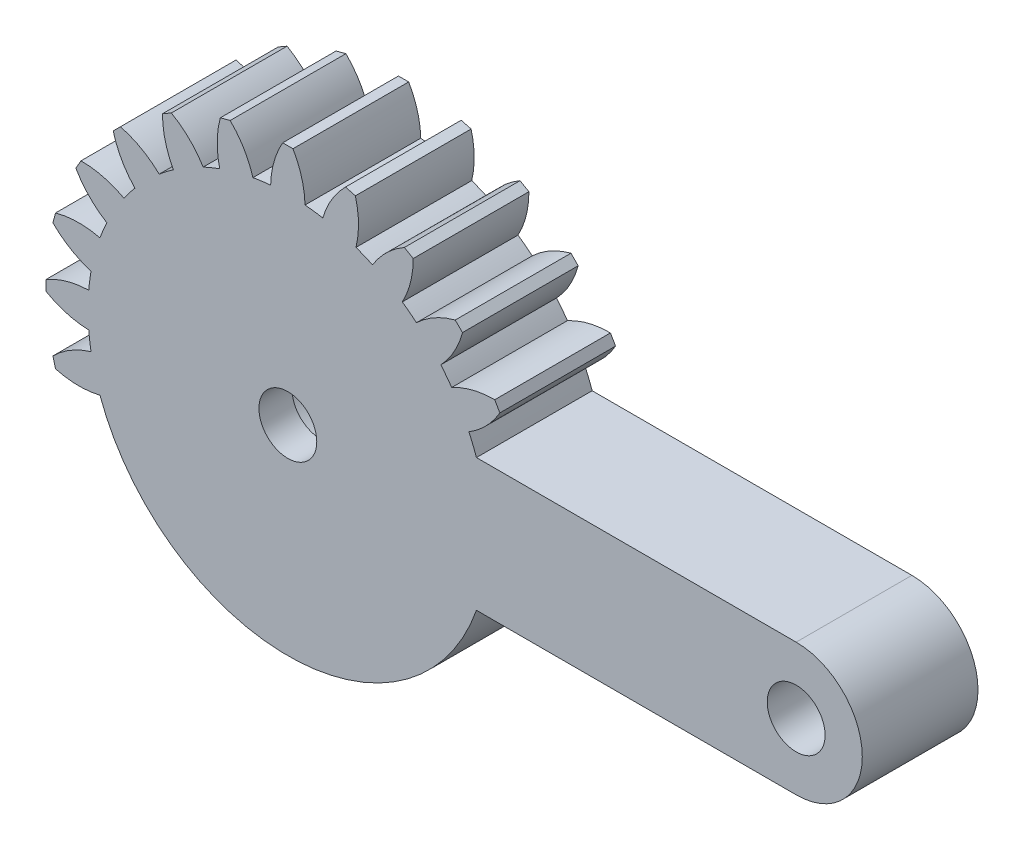
from build123d import *

# Parameters (mm, degrees)
SKETCH1_R           = 12.09
SKETCH1_R_2         = 1.75
BOSS_EXTRUDE2_DEPTH = 7
SKETCH2_R           = 3.5
CUT_EXTRUDE1_DEPTH  = 39.348395012
SKETCH3_R           = 3.5
SKETCH3_R_2         = 1.75
BOSS_EXTRUDE3_DEPTH = 2


with BuildPart() as part:
    # Sketch1 → Boss-Extrude2 (new body)
    # profile 1 of 17: a face of its own
    with BuildSketch(Plane.XY):
        Circle(SKETCH1_R)
    # profile 2 of 17: a face of its own
    with BuildSketch(Plane.XY):
        with BuildLine():
            ThreePointArc((-9.252623584, 7.781841479), (-8.548920985, 8.548920985), (-7.781841479, 9.252623584))
            ThreePointArc((-7.781841479, 9.252623584), (-8.870959341, 10.05645683), (-10.125769107, 10.564175311))
            Line((-10.125769107, 10.564175311), (-10.564175311, 10.125769107))
            ThreePointArc((-10.564175311, 10.125769107), (-10.05645683, 8.870959341), (-9.252623584, 7.781841479))
        make_face()
    # profile 3 of 17: a face of its own
    with BuildSketch(Plane.XY):
        with BuildLine():
            ThreePointArc((-6.9232593, 9.911436862), (-6.045, 10.470247132), (-5.12192646, 10.951436862))
            ThreePointArc((-5.12192646, 10.951436862), (-5.965886177, 12.009764599), (-7.046532125, 12.824951657))
            Line((-7.046532125, 12.824951657), (-7.583467875, 12.514951657))
            ThreePointArc((-7.583467875, 12.514951657), (-7.417818147, 11.171491285), (-6.9232593, 9.911436862))
        make_face()
    # profile 4 of 17: a face of its own
    with BuildSketch(Plane.XY):
        with BuildLine():
            ThreePointArc((-4.122086336, 11.365584201), (-3.129122255, 11.67804324), (-2.112960617, 11.903927815))
            ThreePointArc((-2.112960617, 11.903927815), (-2.65424773, 13.144626757), (-3.487085624, 14.211728743))
            Line((-3.487085624, 14.211728743), (-4.085959636, 14.051260935))
            ThreePointArc((-4.085959636, 14.051260935), (-4.273667417, 12.71070456), (-4.122086336, 11.365584201))
        make_face()
    # profile 5 of 17: a face of its own
    with BuildSketch(Plane.XY):
        with BuildLine():
            Line((0.31, 14.63), (-0.31, 14.63))
            ThreePointArc((-0.31, 14.63), (-0.838273314, 13.383704325), (-1.04, 12.04518576))
            ThreePointArc((-1.04, 12.04518576), (0, 12.09), (1.04, 12.04518576))
            ThreePointArc((1.04, 12.04518576), (0.838273314, 13.383704325), (0.31, 14.63))
        make_face()
    # profile 6 of 17: a face of its own
    with BuildSketch(Plane.XY):
        with BuildLine():
            ThreePointArc((3.487085624, 14.211728743), (2.65424773, 13.144626757), (2.112960617, 11.903927815))
            ThreePointArc((2.112960617, 11.903927815), (3.129122255, 11.67804324), (4.122086336, 11.365584201))
            ThreePointArc((4.122086336, 11.365584201), (4.273667417, 12.71070456), (4.085959636, 14.051260935))
            Line((4.085959636, 14.051260935), (3.487085624, 14.211728743))
        make_face()
    # profile 7 of 17: a face of its own
    with BuildSketch(Plane.XY):
        with BuildLine():
            ThreePointArc((7.046532125, 12.824951657), (5.965886177, 12.009764599), (5.12192646, 10.951436862))
            ThreePointArc((5.12192646, 10.951436862), (6.045, 10.470247132), (6.9232593, 9.911436862))
            ThreePointArc((6.9232593, 9.911436862), (7.417818147, 11.171491285), (7.583467875, 12.514951657))
            Line((7.583467875, 12.514951657), (7.046532125, 12.824951657))
        make_face()
    # profile 8 of 17: a face of its own
    with BuildSketch(Plane.XY):
        with BuildLine():
            ThreePointArc((10.125769107, 10.564175311), (8.870959341, 10.05645683), (7.781841479, 9.252623584))
            ThreePointArc((7.781841479, 9.252623584), (8.548920985, 8.548920985), (9.252623584, 7.781841479))
            ThreePointArc((9.252623584, 7.781841479), (10.05645683, 8.870959341), (10.564175311, 10.125769107))
            Line((10.564175311, 10.125769107), (10.125769107, 10.564175311))
        make_face()
    # profile 9 of 17: a face of its own
    with BuildSketch(Plane.XY):
        with BuildLine():
            ThreePointArc((12.514951657, 7.583467875), (11.171491285, 7.417818147), (9.911436862, 6.9232593))
            ThreePointArc((9.911436862, 6.9232593), (10.470247132, 6.045), (10.951436862, 5.12192646))
            ThreePointArc((10.951436862, 5.12192646), (12.009764599, 5.965886177), (12.824951657, 7.046532125))
            Line((12.824951657, 7.046532125), (12.514951657, 7.583467875))
        make_face()
    # profile 10 of 17: a face of its own
    with BuildSketch(Plane.XY):
        with BuildLine():
            Line((14.07429375, 4), (11.409123542, 4))
            ThreePointArc((11.409123542, 4), (11.694649217, 3.066476756), (11.903927815, 2.112960617))
            ThreePointArc((11.903927815, 2.112960617), (13.144626757, 2.65424773), (14.211728743, 3.487085624))
            Line((14.211728743, 3.487085624), (14.07429375, 4))
        make_face()
    # profile 11 of 17: a face of its own
    with BuildSketch(Plane.XY):
        with BuildLine():
            Line((30.75, 4), (14.07429375, 4))
            Line((14.07429375, 4), (14.211728743, 3.487085624))
            ThreePointArc((14.211728743, 3.487085624), (13.144626757, 2.65424773), (11.903927815, 2.112960617))
            ThreePointArc((11.903927815, 2.112960617), (11.986568374, 1.578061664), (12.04518576, 1.04))
            ThreePointArc((12.04518576, 1.04), (13.383704325, 0.838273314), (14.63, 0.31))
            Line((14.63, 0.31), (14.63, -0.31))
            ThreePointArc((14.63, -0.31), (13.383704325, -0.838273314), (12.04518576, -1.04))
            ThreePointArc((12.04518576, -1.04), (11.986568374, -1.578061664), (11.903927815, -2.112960617))
            ThreePointArc((11.903927815, -2.112960617), (13.144626757, -2.65424773), (14.211728743, -3.487085624))
            Line((14.211728743, -3.487085624), (14.07429375, -4))
            Line((14.07429375, -4), (30.75, -4))
            ThreePointArc((30.75, -4), (34.75, 0), (30.75, 4))
        make_face()
        with Locations((30.75, 0)):
            Circle(SKETCH1_R_2, mode=Mode.SUBTRACT)
    # profile 12 of 17: a face of its own
    with BuildSketch(Plane.XY):
        with BuildLine():
            ThreePointArc((14.63, 0.31), (13.383704325, 0.838273314), (12.04518576, 1.04))
            ThreePointArc((12.04518576, 1.04), (12.078791244, 0.520482544), (12.09, 0))
            ThreePointArc((12.09, 0), (12.078791244, -0.520482544), (12.04518576, -1.04))
            ThreePointArc((12.04518576, -1.04), (13.383704325, -0.838273314), (14.63, -0.31))
            Line((14.63, -0.31), (14.63, 0.31))
        make_face()
    # profile 13 of 17: a face of its own
    with BuildSketch(Plane.XY):
        with BuildLine():
            Line((11.409123542, -4), (14.07429375, -4))
            Line((14.07429375, -4), (14.211728743, -3.487085624))
            ThreePointArc((14.211728743, -3.487085624), (13.144626757, -2.65424773), (11.903927815, -2.112960617))
            ThreePointArc((11.903927815, -2.112960617), (11.694649217, -3.066476756), (11.409123542, -4))
        make_face()
    # profile 14 of 17: a face of its own
    with BuildSketch(Plane.XY):
        with BuildLine():
            ThreePointArc((-10.951436862, 5.12192646), (-10.470247132, 6.045), (-9.911436862, 6.9232593))
            ThreePointArc((-9.911436862, 6.9232593), (-11.171491285, 7.417818147), (-12.514951657, 7.583467875))
            Line((-12.514951657, 7.583467875), (-12.824951657, 7.046532125))
            ThreePointArc((-12.824951657, 7.046532125), (-12.009764599, 5.965886177), (-10.951436862, 5.12192646))
        make_face()
    # profile 15 of 17: a face of its own
    with BuildSketch(Plane.XY):
        with BuildLine():
            ThreePointArc((-11.903927815, 2.112960617), (-11.67804324, 3.129122255), (-11.365584201, 4.122086336))
            ThreePointArc((-11.365584201, 4.122086336), (-12.71070456, 4.273667417), (-14.051260935, 4.085959636))
            Line((-14.051260935, 4.085959636), (-14.211728743, 3.487085624))
            ThreePointArc((-14.211728743, 3.487085624), (-13.144626757, 2.65424773), (-11.903927815, 2.112960617))
        make_face()
    # profile 16 of 17: a face of its own
    with BuildSketch(Plane.XY):
        with BuildLine():
            ThreePointArc((-12.04518576, -1.04), (-12.09, 0), (-12.04518576, 1.04))
            ThreePointArc((-12.04518576, 1.04), (-13.383704325, 0.838273314), (-14.63, 0.31))
            Line((-14.63, 0.31), (-14.63, -0.31))
            ThreePointArc((-14.63, -0.31), (-13.383704325, -0.838273314), (-12.04518576, -1.04))
        make_face()
    # profile 17 of 17: a face of its own
    with BuildSketch(Plane.XY):
        with BuildLine():
            ThreePointArc((-11.365584201, -4.122086336), (-11.67804324, -3.129122255), (-11.903927815, -2.112960617))
            ThreePointArc((-11.903927815, -2.112960617), (-13.144626757, -2.65424773), (-14.211728743, -3.487085624))
            Line((-14.211728743, -3.487085624), (-14.051260935, -4.085959636))
            ThreePointArc((-14.051260935, -4.085959636), (-12.71070456, -4.273667417), (-11.365584201, -4.122086336))
        make_face()
    extrude(amount=BOSS_EXTRUDE2_DEPTH)

    # Sketch2 → Cut-Extrude1 (cut, through all)
    with BuildSketch(Plane.XY.offset(7)):
        Circle(SKETCH2_R)
    extrude(amount=-CUT_EXTRUDE1_DEPTH, mode=Mode.SUBTRACT)

    # Sketch3 → Boss-Extrude3 (add)
    with BuildSketch(Plane.XY.offset(7)):
        Circle(SKETCH3_R)
        Circle(SKETCH3_R_2, mode=Mode.SUBTRACT)
    extrude(amount=-BOSS_EXTRUDE3_DEPTH)


solid = part.part
